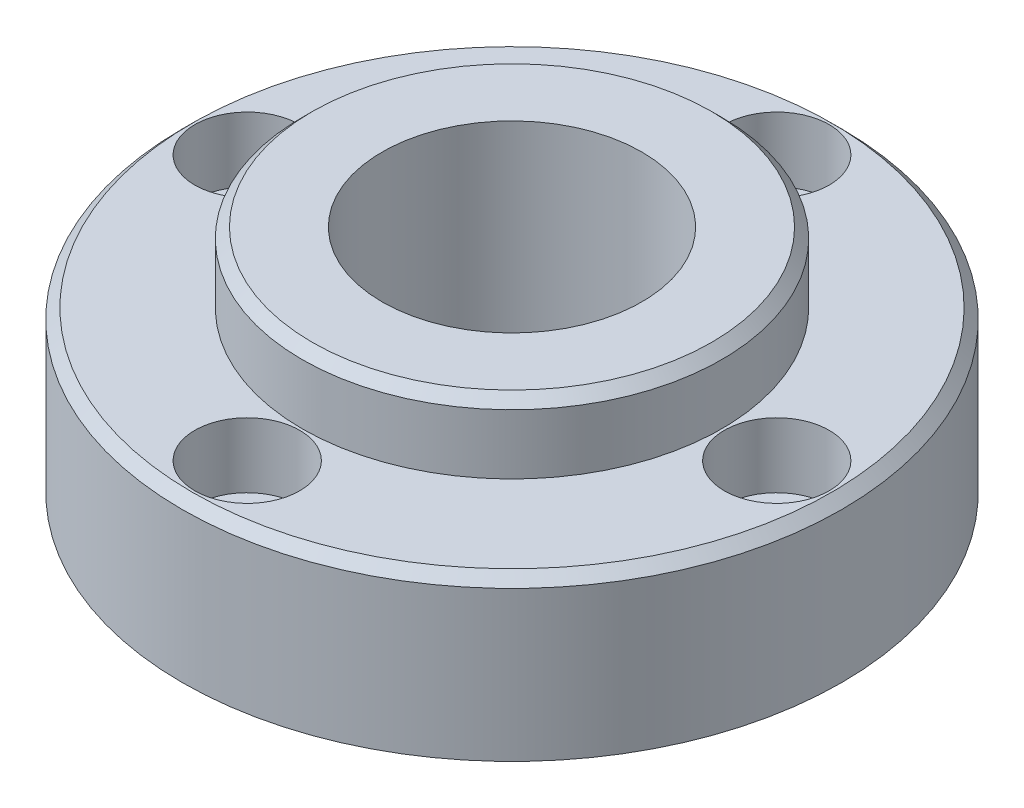
from build123d import *

# Parameters (mm, degrees)
CROQUIS1_R              = 33
SALIENTE_EXTRUIR1_DEPTH = 16
CROQUIS2_R              = 21
SALIENTE_EXTRUIR2_DEPTH = 7
CROQUIS3_R              = 17
SALIENTE_EXTRUIR3_DEPTH = 1.5
CROQUIS4_R              = 13
CORTAR_EXTRUIR1_DEPTH   = 53.709107372
CHAFL_N1_SIZE           = 1
CROQUIS5_R              = 5.25
CORTAR_EXTRUIR2_DEPTH   = 6.5
CROQUIS6_R              = 3.25
CORTAR_EXTRUIR3_DEPTH   = 49.582404222
MATRIZC1_COUNT          = 4
CHAFL_N2_SIZE           = 1


with BuildPart() as part:
    # Croquis1 → Saliente-Extruir1 (new body)
    with BuildSketch(Plane(origin=(0, 0, 0), x_dir=(1, 0, 0), z_dir=(0, 1, 0))):
        with Locations(Location((0, 0, 0), (0, 0, 270))):
            Circle(CROQUIS1_R)
    extrude(amount=SALIENTE_EXTRUIR1_DEPTH)

    # Croquis2 → Saliente-Extruir2 (add)
    with BuildSketch(Plane(origin=(0, 16, 0), x_dir=(1, 0, 0), z_dir=(0, 1, 0))):
        with Locations(Location((0, 0, 0), (0, 0, 270))):
            Circle(CROQUIS2_R)
    extrude(amount=SALIENTE_EXTRUIR2_DEPTH)

    # Croquis3 → Saliente-Extruir3 (add)
    with BuildSketch(Plane.XZ):
        with Locations(Location((0, 0, 0), (0, 0, 90))):
            Circle(CROQUIS3_R)
    extrude(amount=SALIENTE_EXTRUIR3_DEPTH)

    # Croquis4 → Cortar-Extruir1 (cut, through all)
    with BuildSketch(Plane(origin=(0, 23, 0), x_dir=(1, 0, 0), z_dir=(0, 1, 0))):
        with Locations(Location((0, 0, 0), (0, 0, 270))):
            Circle(CROQUIS4_R)
    extrude(amount=-CORTAR_EXTRUIR1_DEPTH, mode=Mode.SUBTRACT)

    # Chaflán1
    chafl_n1_edges = [part.edges().sort_by_distance(p)[0] for p in [
        (0, 16, -33),
    ]]
    chamfer(chafl_n1_edges, length=CHAFL_N1_SIZE)

    # Croquis5 → Cortar-Extruir2 (cut)
    with BuildSketch(Plane(origin=(0, 16, 0), x_dir=(1, 0, 0), z_dir=(0, 1, 0))):
        with Locations(Location((26.5, 0, 0), (0, 0, 270))):
            Circle(CROQUIS5_R)
    cortar_extruir2 = extrude(amount=-CORTAR_EXTRUIR2_DEPTH, mode=Mode.SUBTRACT)

    # Croquis6 → Cortar-Extruir3 (cut, through all)
    with BuildSketch(Plane(origin=(0, 9.5, 0), x_dir=(1, 0, 0), z_dir=(0, 1, 0))):
        with Locations(Location((26.5, 0, 0), (0, 0, 270))):
            Circle(CROQUIS6_R)
    cortar_extruir3 = extrude(amount=-CORTAR_EXTRUIR3_DEPTH, mode=Mode.SUBTRACT)

    # MatrizC1: Cortar-Extruir2, Cortar-Extruir3 ×4 about axis
    matrizc1_axis = Axis((0, 0, 0), (0, 1, 0))
    add([cortar_extruir2.rotate(matrizc1_axis, i * 360 / MATRIZC1_COUNT) for i in range(1, MATRIZC1_COUNT)], mode=Mode.SUBTRACT)
    add([cortar_extruir3.rotate(matrizc1_axis, i * 360 / MATRIZC1_COUNT) for i in range(1, MATRIZC1_COUNT)], mode=Mode.SUBTRACT)

    # Chaflán2
    chafl_n2_edges = [part.edges().sort_by_distance(p)[0] for p in [
        (0, 23, -21),
    ]]
    chamfer(chafl_n2_edges, length=CHAFL_N2_SIZE)


solid = part.part
